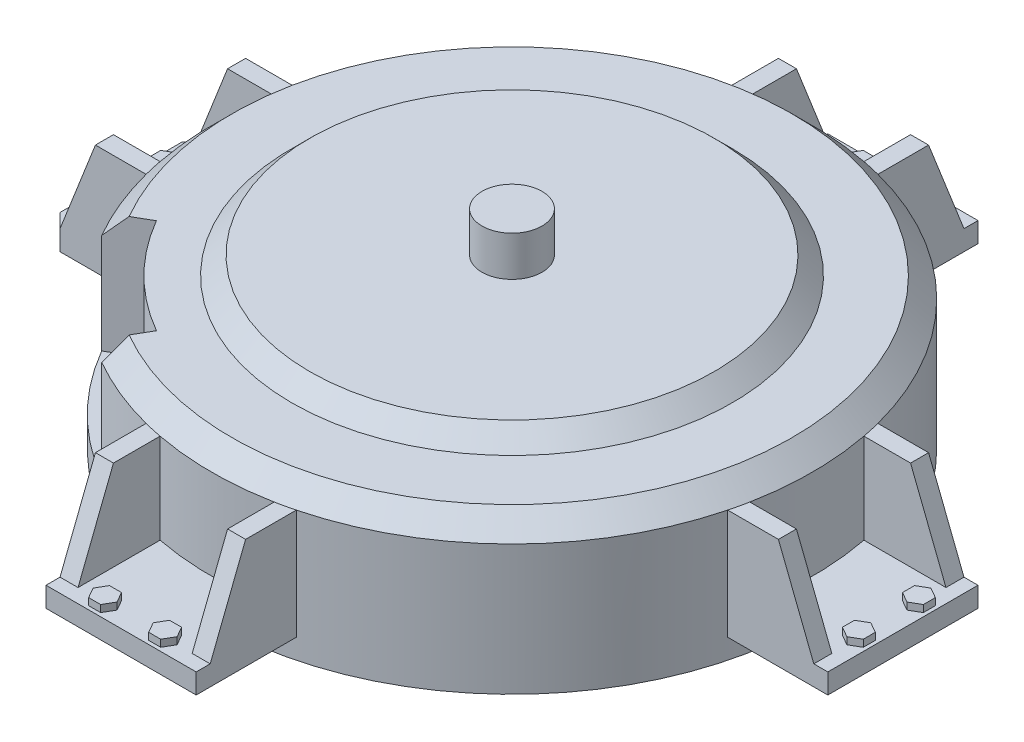
from build123d import *

# Parameters (mm, degrees)
SKETCH1_R                = 150
BOSS_EXTRUDE1_DEPTH      = 75
CHAMFER1_SIZE            = 10
BOSS_EXTRUDE2_START      = -65
BOSS_EXTRUDE2_DEPTH      = 10
CHAMFER2_SIZE            = 7
BOSS_EXTRUDE3_DEPTH      = 9
BOSS_EXTRUDE4_DEPTH      = 3.5
CIRPATTERN1_COUNT        = 4
CIRPATTERN1_COPY_1_DEPTH = 9
CIRPATTERN1_COPY_2_DEPTH = 9
CIRPATTERN1_COPY_3_DEPTH = 9
CIRPATTERN1_COPY_4_DEPTH = 3.5
CIRPATTERN1_COPY_5_DEPTH = 3.5
CIRPATTERN1_COPY_6_DEPTH = 3.5
CUT_EXTRUDE1_START       = -60
CUT_EXTRUDE1_DEPTH       = 60
SKETCH6_R                = 110
BOSS_EXTRUDE5_DEPTH      = 9
BOSS_EXTRUDE5_TAPER      = 45
SKETCH7_R                = 15
BOSS_EXTRUDE6_DEPTH      = 20


with BuildPart() as part:
    # Sketch1 → Boss-Extrude1 (new body)
    with BuildSketch(Plane(origin=(0, 0, 0), x_dir=(1, 0, 0), z_dir=(0, 1, 0))):
        with Locations(Location((0, 0, 0), (0, 0, 270))):
            Circle(SKETCH1_R)
    extrude(amount=BOSS_EXTRUDE1_DEPTH)

    # Chamfer1
    chamfer1_edges = [part.edges().sort_by_distance(p)[0] for p in [
        (0, 75, -150),
    ]]
    chamfer(chamfer1_edges, length=CHAMFER1_SIZE)

    # Sketch2 → Boss-Extrude2 (add)
    with BuildSketch(Plane(origin=(0, 75, 0), x_dir=(1, 0, 0), z_dir=(0, 1, 0)).offset(BOSS_EXTRUDE2_START)):
        with BuildLine():
            Line((-145.236875483, 37.5), (-195.236875483, 37.5))
            Line((-195.236875483, 37.5), (-195.236875483, -37.5))
            Line((-195.236875483, -37.5), (-145.236875483, -37.5))
            ThreePointArc((-145.236875483, -37.5), (-150, 0), (-145.236875483, 37.5))
        make_face()
    boss_extrude2 = extrude(amount=BOSS_EXTRUDE2_DEPTH)

    # Chamfer2
    chamfer2_edges = [part.edges().sort_by_distance(p)[0] for p in [
        (-195.236875483, 15, -37.5),
        (-195.236875483, 15, 37.5),
    ]]
    chamfer(chamfer2_edges, length=CHAMFER2_SIZE)

    # Sketch3 → Boss-Extrude3 (add)
    with BuildSketch(Plane.XY.offset(37.5)):
        Polygon((-145.236875483, 20), (-145.236875483, 65), (-170.556875483, 65), (-188.236875483, 20), align=None)
    boss_extrude3 = extrude(amount=-BOSS_EXTRUDE3_DEPTH)

    # Sketch4 → Boss-Extrude4 (add)
    with BuildSketch(Plane(origin=(0, 20, 0), x_dir=(1, 0, 0), z_dir=(0, 1, 0))):
        Polygon((-183.04072306, -12), (-188.236875483, -9), (-193.433027905, -12), (-193.433027905, -18), (-188.236875483, -21), (-183.04072306, -18), align=None)
    boss_extrude4 = extrude(amount=BOSS_EXTRUDE4_DEPTH)

    # Mirror1: Boss-Extrude3, Boss-Extrude4 across plane
    add(boss_extrude3.mirror(Plane.XY))
    add(boss_extrude4.mirror(Plane.XY))

    # CirPattern1: Boss-Extrude2, Boss-Extrude3, Boss-Extrude4 ×4 about axis
    cirpattern1_axis = Axis((0, 0, 0), (0, 1, 0))
    add([boss_extrude2.rotate(cirpattern1_axis, i * 360 / CIRPATTERN1_COUNT) for i in range(1, CIRPATTERN1_COUNT)])
    add([boss_extrude3.rotate(cirpattern1_axis, i * 360 / CIRPATTERN1_COUNT) for i in range(1, CIRPATTERN1_COUNT)])
    add([boss_extrude4.rotate(cirpattern1_axis, i * 360 / CIRPATTERN1_COUNT) for i in range(1, CIRPATTERN1_COUNT)])

    # CirPattern1 copy 1 sketch → CirPattern1 copy 1 (add)
    with BuildSketch(Plane(origin=(-37.5, 0, 0), x_dir=(0, 0, -1), z_dir=(-1, 0, 0))):
        Polygon((-145.236875483, -20), (-145.236875483, -65), (-170.556875483, -65), (-188.236875483, -20), align=None)
    extrude(amount=-CIRPATTERN1_COPY_1_DEPTH)

    # CirPattern1 copy 2 sketch → CirPattern1 copy 2 (add)
    with BuildSketch(Plane(origin=(0, 0, 37.5), x_dir=(-1, 0, 0), z_dir=(0, 0, 1))):
        Polygon((-145.236875483, -20), (-145.236875483, -65), (-170.556875483, -65), (-188.236875483, -20), align=None)
    extrude(amount=-CIRPATTERN1_COPY_2_DEPTH)

    # CirPattern1 copy 3 sketch → CirPattern1 copy 3 (add)
    with BuildSketch(Plane(origin=(37.5, 0, 0), x_dir=(0, 0, 1), z_dir=(1, 0, 0))):
        Polygon((-145.236875483, -20), (-145.236875483, -65), (-170.556875483, -65), (-188.236875483, -20), align=None)
    extrude(amount=-CIRPATTERN1_COPY_3_DEPTH)

    # CirPattern1 copy 4 sketch → CirPattern1 copy 4 (add)
    with BuildSketch(Plane(origin=(0, 20, 0), x_dir=(0, 0, -1), z_dir=(0, 1, 0))):
        Polygon((-183.04072306, 12), (-188.236875483, 9), (-193.433027905, 12), (-193.433027905, 18), (-188.236875483, 21), (-183.04072306, 18), align=None)
    extrude(amount=CIRPATTERN1_COPY_4_DEPTH)

    # CirPattern1 copy 5 sketch → CirPattern1 copy 5 (add)
    with BuildSketch(Plane(origin=(0, 20, 0), x_dir=(-1, 0, 0), z_dir=(0, 1, 0))):
        Polygon((-183.04072306, 12), (-188.236875483, 9), (-193.433027905, 12), (-193.433027905, 18), (-188.236875483, 21), (-183.04072306, 18), align=None)
    extrude(amount=CIRPATTERN1_COPY_5_DEPTH)

    # CirPattern1 copy 6 sketch → CirPattern1 copy 6 (add)
    with BuildSketch(Plane.ZX.offset(20)):
        Polygon((-183.04072306, 12), (-188.236875483, 9), (-193.433027905, 12), (-193.433027905, 18), (-188.236875483, 21), (-183.04072306, 18), align=None)
    extrude(amount=CIRPATTERN1_COPY_6_DEPTH)

    # Sketch5 → Cut-Extrude1 (cut)
    with BuildSketch(Plane(origin=(0, 75, 0), x_dir=(1, 0, 0), z_dir=(0, 1, 0)).offset(CUT_EXTRUDE1_START)):
        with BuildLine():
            Line((-112.583302492, -65), (-129.903810568, -75))
            ThreePointArc((-129.903810568, -75), (-106.066017178, -106.066017178), (-75, -129.903810568))
            Line((-75, -129.903810568), (-65, -112.583302492))
            ThreePointArc((-65, -112.583302492), (-91.923881554, -91.923881554), (-112.583302492, -65))
        make_face()
    extrude(amount=CUT_EXTRUDE1_DEPTH, mode=Mode.SUBTRACT)

    # Sketch6 → Boss-Extrude5 (add)
    with BuildSketch(Plane(origin=(0, 75, 0), x_dir=(1, 0, 0), z_dir=(0, 1, 0))):
        Circle(SKETCH6_R)
    extrude(amount=BOSS_EXTRUDE5_DEPTH, taper=BOSS_EXTRUDE5_TAPER)

    # Sketch7 → Boss-Extrude6 (add)
    with BuildSketch(Plane(origin=(0, 84, 0), x_dir=(1, 0, 0), z_dir=(0, 1, 0))):
        with Locations(Location((0, 0, 0), (0, 0, 270))):
            Circle(SKETCH7_R)
    extrude(amount=BOSS_EXTRUDE6_DEPTH)


solid = part.part
